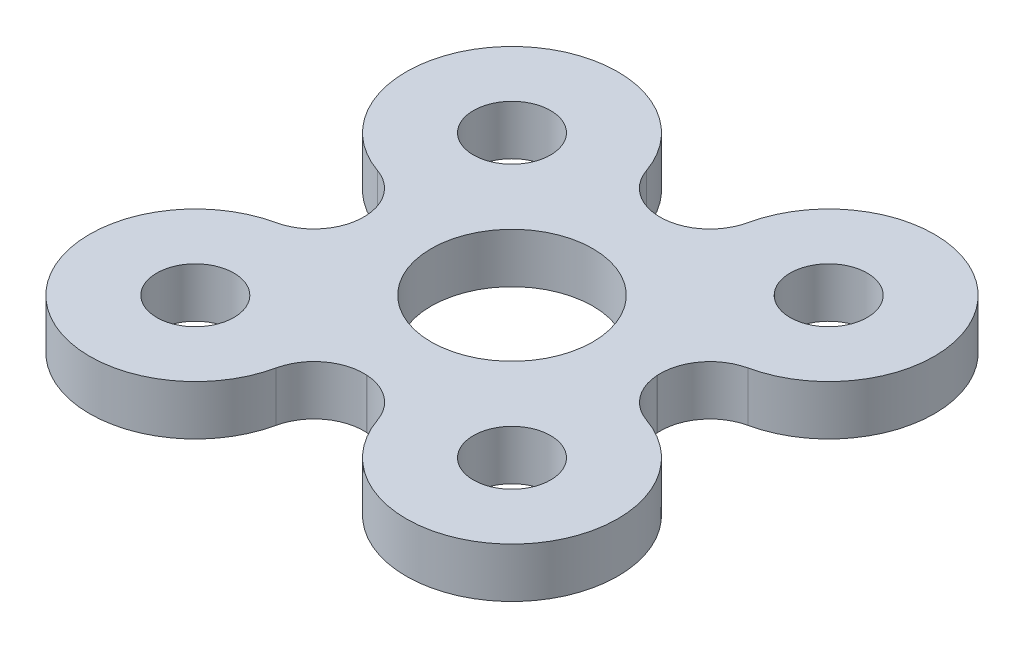
from build123d import *

# Parameters (mm, degrees)
SKETCH1_R           = 1.55
SKETCH1_R_2         = 3.25
BOSS_EXTRUDE2_DEPTH = 2
FILLET1_R           = 2


with BuildPart() as part:
    # Sketch1 → Boss-Extrude2 (new body)
    with BuildSketch(Plane(origin=(0, 0, 0), x_dir=(1, 0, 0), z_dir=(0, 1, 0))):
        with BuildLine():
            ThreePointArc((-1.43909166, 6.179327925), (-8.65976943, 8.664344967), (-6.18574902, 1.439892035))
            ThreePointArc((-6.18574902, 1.439892035), (-5.7, -0.338953386), (-6.18574902, -2.117798807))
            ThreePointArc((-6.18574902, -2.117798807), (-9.366987419, -9.371531966), (-2.118073304, -6.179327925))
            ThreePointArc((-2.118073304, -6.179327925), (-0.339490822, -5.693734061), (1.43909166, -6.179327925))
            ThreePointArc((1.43909166, -6.179327925), (8.65976943, -8.664344967), (6.18574902, -1.439892035))
            ThreePointArc((6.18574902, -1.439892035), (5.7, 0.338953386), (6.18574902, 2.117798807))
            ThreePointArc((6.18574902, 2.117798807), (9.366987419, 9.371531966), (2.118073304, 6.179327925))
            ThreePointArc((2.118073304, 6.179327925), (0.339490822, 5.693734061), (-1.43909166, 6.179327925))
        make_face()
        with Locations(Location((-6.364056731, -6.364056731, 0), (0, 0, 270))):
            Circle(SKETCH1_R, mode=Mode.SUBTRACT)
        with Locations(Location((6.364056731, 6.364056731, 0), (0, 0, 270))):
            Circle(SKETCH1_R, mode=Mode.SUBTRACT)
        with Locations(Location((5.656854249, -5.656854249, 0), (0, 0, 270))):
            Circle(SKETCH1_R, mode=Mode.SUBTRACT)
        with Locations(Location((-5.656854249, 5.656854249, 0), (0, 0, 270))):
            Circle(SKETCH1_R, mode=Mode.SUBTRACT)
        with Locations(Location((0, 0, 0), (0, 0, 270))):
            Circle(SKETCH1_R_2, mode=Mode.SUBTRACT)
    extrude(amount=-BOSS_EXTRUDE2_DEPTH)

    # Fillet1
    fillet1_edges = [part.edges().sort_by_distance(p)[0] for p in [
        (-2.118073304, -1, 6.179327925),
        (-6.18574902, -1, 2.117798807),
        (-6.18574902, -1, -1.439892035),
        (-1.43909166, -1, -6.179327925),
        (2.118073304, -1, -6.179327925),
        (6.18574902, -1, -2.117798807),
        (6.18574902, -1, 1.439892035),
        (1.43909166, -1, 6.179327925),
    ]]
    fillet(fillet1_edges, radius=FILLET1_R)


solid = part.part
